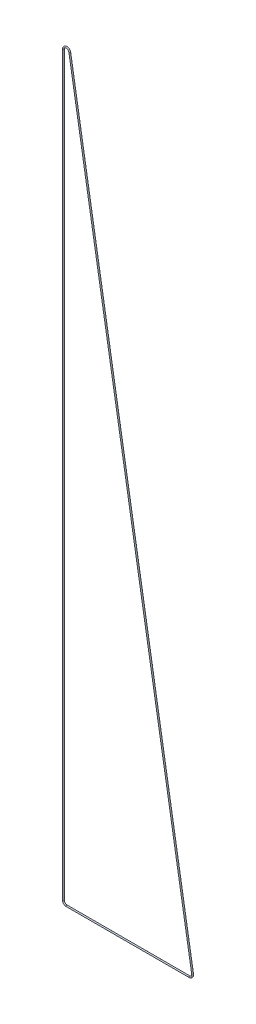
from build123d import *

# Parameters (mm, degrees)
CROQUIS2_R = 2


with BuildPart() as part:
    # Barrer1: sweep along a path in Croquis1
    with BuildLine(Plane.XY) as barrer1_path:
        Line((0, 10), (0, 2279.172374697))
        ThreePointArc((0, 2279.172374697), (9.175194685, 2289.138301457), (19.863939238, 2280.81636457))
        Line((19.863939238, 2280.81636457), (398.059335021, 11.643989873))
        ThreePointArc((398.059335021, 11.643989873), (395.825595608, 3.536251039), (388.195395783, 0))
        Line((388.195395783, 0), (10, 0))
        ThreePointArc((10, 0), (2.928932188, 2.928932188), (0, 10))
    # Croquis2 → Barrer1 (sweep)
    with BuildSketch(Plane(origin=(10, 0, 0), x_dir=(0, 0, -1), z_dir=(1, 0, 0))):
        Circle(CROQUIS2_R)
    sweep(path=barrer1_path.line)


solid = part.part
